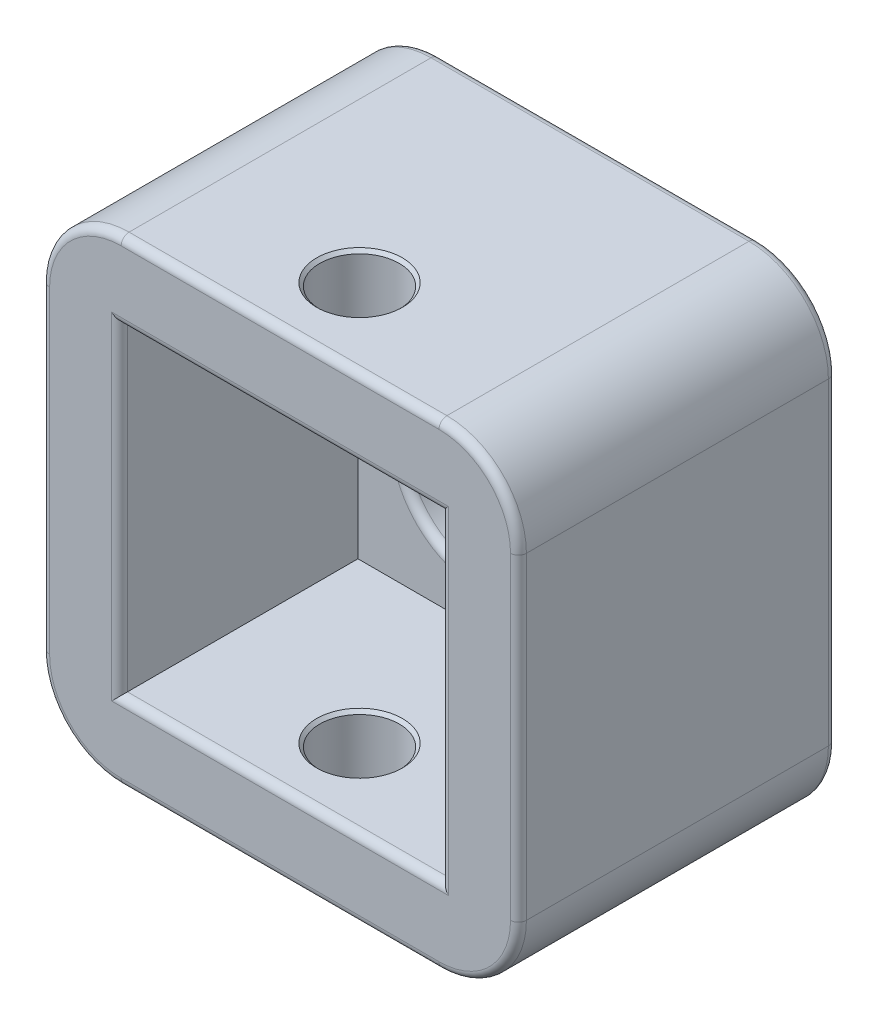
from build123d import *

# Parameters (mm, degrees)
SKETCH1_W           = 30
SKETCH1_H           = 30
BOSS_EXTRUDE1_DEPTH = 20
SKETCH2_W           = 20.2
SKETCH2_H           = 20.2
CUT_EXTRUDE1_DEPTH  = 15
SKETCH3_R           = 2.5
CUT_EXTRUDE2_DEPTH  = 40.05124838
SKETCH4_W           = 15
SKETCH4_H           = 15
CUT_EXTRUDE3_DEPTH  = 26.980762114
FILLET2_R           = 5
FILLET1_R           = 0.5
CHAMFER1_SIZE       = 0.2


with BuildPart() as part:
    # Sketch1 → Boss-Extrude1 (new body)
    with BuildSketch(Plane.XY):
        Rectangle(SKETCH1_W, SKETCH1_H)
    extrude(amount=BOSS_EXTRUDE1_DEPTH)

    # Sketch2 → Cut-Extrude1 (cut)
    with BuildSketch(Plane.XY.offset(20)):
        Rectangle(SKETCH2_W, SKETCH2_H)
    extrude(amount=-CUT_EXTRUDE1_DEPTH, mode=Mode.SUBTRACT)

    # Sketch3 → Cut-Extrude2 (cut, through all)
    with BuildSketch(Plane.XZ.offset(15)):
        with Locations(Location((0, 15, 0), (0, 0, 270))):
            Circle(SKETCH3_R)
    extrude(amount=-CUT_EXTRUDE2_DEPTH, mode=Mode.SUBTRACT)

    # Sketch4 → Cut-Extrude3 (cut, through all)
    with BuildSketch(Plane.XY.offset(5)):
        Rectangle(SKETCH4_W, SKETCH4_H)
    extrude(amount=-CUT_EXTRUDE3_DEPTH, mode=Mode.SUBTRACT)

    # Fillet2
    fillet2_edges = [part.edges().sort_by_distance(p)[0] for p in [
        (7.5, 7.5, 2.5),
        (7.5, -7.5, 2.5),
        (-7.5, -7.5, 2.5),
        (-7.5, 7.5, 2.5),
        (15, -15, 10),
        (-15, -15, 10),
        (-15, 15, 10),
        (15, 15, 10),
    ]]
    fillet(fillet2_edges, radius=FILLET2_R)

    # Fillet1
    fillet1_edges = [part.edges().sort_by_distance(p)[0] for p in [
        (10.1, 0, 20),
        (0, 10.1, 20),
        (-10.1, 0, 20),
        (0, -10.1, 20),
        (0, -7.5, 5),
        (0, -7.5, 0),
        (-7.5, 0, 5),
        (-7.5, 0, 0),
        (7.5, 0, 5),
        (7.5, 0, 0),
        (0, 7.5, 5),
        (0, 7.5, 0),
        (0, 15, 0),
        (0, 15, 20),
        (15, 0, 0),
        (0, -15, 0),
        (-15, 0, 0),
        (13.535533906, -13.535533906, 0),
        (-13.535533906, -13.535533906, 0),
        (-13.535533906, 13.535533906, 0),
        (13.535533906, 13.535533906, 0),
        (15, 0, 20),
        (-15, 0, 20),
        (0, -15, 20),
        (13.535533906, -13.535533906, 20),
        (-13.535533906, -13.535533906, 20),
        (-13.535533906, 13.535533906, 20),
        (13.535533906, 13.535533906, 20),
        (-6.035533906, -6.035533906, 5),
        (-6.035533906, -6.035533906, 0),
        (6.035533906, -6.035533906, 5),
        (6.035533906, -6.035533906, 0),
        (6.035533906, 6.035533906, 5),
        (6.035533906, 6.035533906, 0),
        (-6.035533906, 6.035533906, 5),
        (-6.035533906, 6.035533906, 0),
    ]]
    fillet(fillet1_edges, radius=FILLET1_R)

    # Chamfer1
    chamfer1_edges = [part.edges().sort_by_distance(p)[0] for p in [
        (0, 15, 17.5),
        (0, 10.1, 17.5),
        (0, -10.1, 17.5),
        (0, -15, 17.5),
    ]]
    chamfer(chamfer1_edges, length=CHAMFER1_SIZE)


solid = part.part
